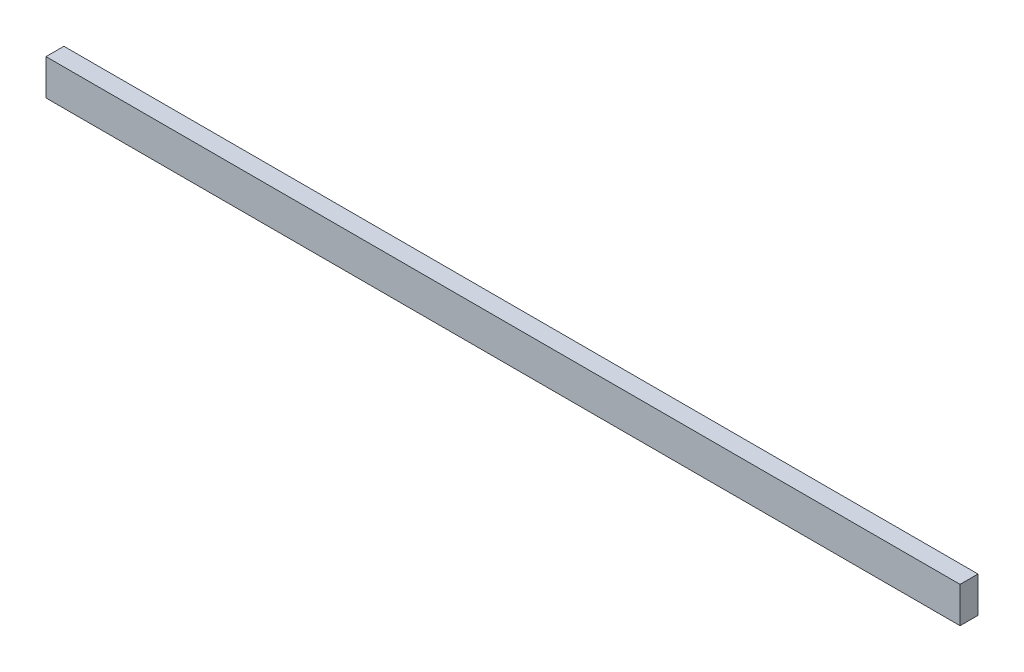
from build123d import *

# Parameters (mm, degrees)
ESQUISSE1_W        = 51
ESQUISSE1_H        = 2
BOSS_EXTRU_1_DEPTH = 1


with BuildPart() as part:
    # Esquisse1 → Boss.-Extru.1 (new body)
    with BuildSketch(Plane.XY):
        Rectangle(ESQUISSE1_W, ESQUISSE1_H)
    extrude(amount=BOSS_EXTRU_1_DEPTH)


solid = part.part
